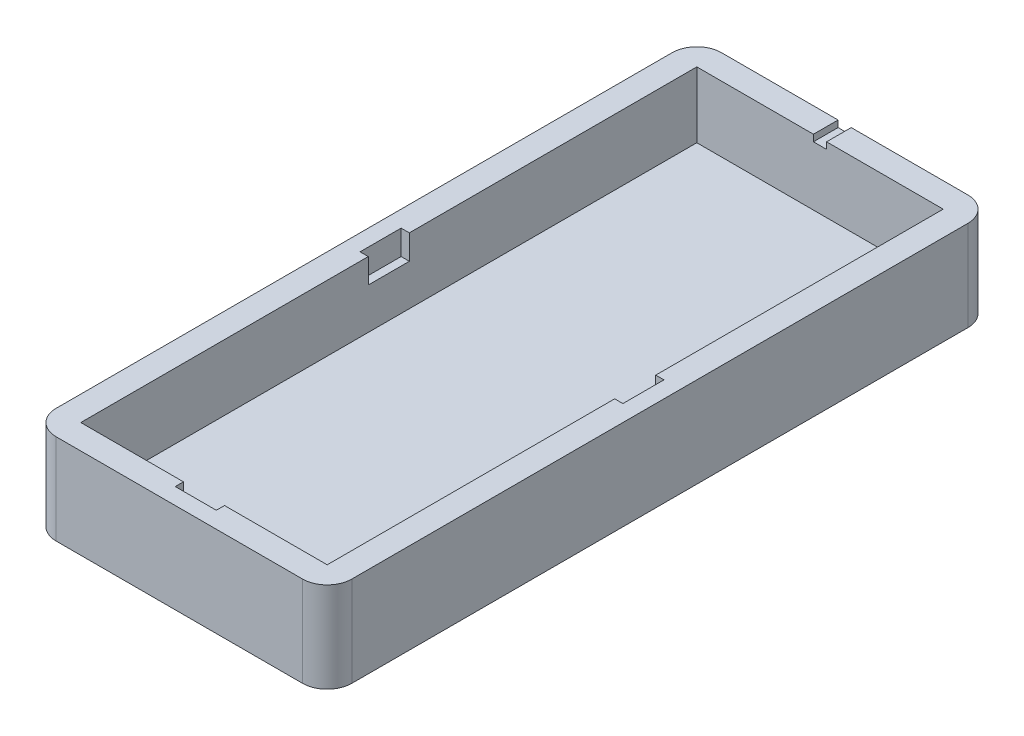
from build123d import *

# Parameters (mm, degrees)
SKETCH1_W           = 36
SKETCH1_H           = 81
BOSS_EXTRUDE1_DEPTH = 11
SKETCH2_W           = 30
SKETCH2_H           = 75
CUT_EXTRUDE1_DEPTH  = 8
FILLET1_R           = 3
SKETCH3_W           = 1.6
SKETCH3_H           = 3
CUT_EXTRUDE2_DEPTH  = 0.8
SKETCH4_W           = 1
SKETCH4_H           = 5
SKETCH4_W_2         = 5
SKETCH4_H_2         = 1
CUT_EXTRUDE3_DEPTH  = 3


with BuildPart() as part:
    # Sketch1 → Boss-Extrude1 (new body)
    with BuildSketch(Plane(origin=(0, 0, 0), x_dir=(1, 0, 0), z_dir=(0, 1, 0))):
        with Locations((18, 40.5)):
            Rectangle(SKETCH1_W, SKETCH1_H)
    extrude(amount=BOSS_EXTRUDE1_DEPTH)

    # Sketch2 → Cut-Extrude1 (cut)
    with BuildSketch(Plane(origin=(0, 11, 0), x_dir=(1, 0, 0), z_dir=(0, 1, 0))):
        with Locations((18, 40.5)):
            Rectangle(SKETCH2_W, SKETCH2_H)
    extrude(amount=-CUT_EXTRUDE1_DEPTH, mode=Mode.SUBTRACT)

    # Fillet1
    fillet1_edges = [part.edges().sort_by_distance(p)[0] for p in [
        (0, 5.5, -81),
        (36, 5.5, -81),
        (36, 5.5, 0),
        (0, 5.5, 0),
    ]]
    fillet(fillet1_edges, radius=FILLET1_R)

    # Sketch3 → Cut-Extrude2 (cut)
    with BuildSketch(Plane(origin=(0, 11, 0), x_dir=(1, 0, 0), z_dir=(0, 1, 0))):
        with Locations((18, 79.5)):
            Rectangle(SKETCH3_W, SKETCH3_H)
    extrude(amount=-CUT_EXTRUDE2_DEPTH, mode=Mode.SUBTRACT)

    # Sketch4 → Cut-Extrude3 (cut)
    with BuildSketch(Plane(origin=(0, 11, 0), x_dir=(1, 0, 0), z_dir=(0, 1, 0))):
        with Locations((2.5, 40.5)):
            Rectangle(SKETCH4_W, SKETCH4_H)
        with Locations((33.5, 40.5)):
            Rectangle(SKETCH4_W, SKETCH4_H)
        with Locations((18, 2.5)):
            Rectangle(SKETCH4_W_2, SKETCH4_H_2)
    extrude(amount=-CUT_EXTRUDE3_DEPTH, mode=Mode.SUBTRACT)


solid = part.part
